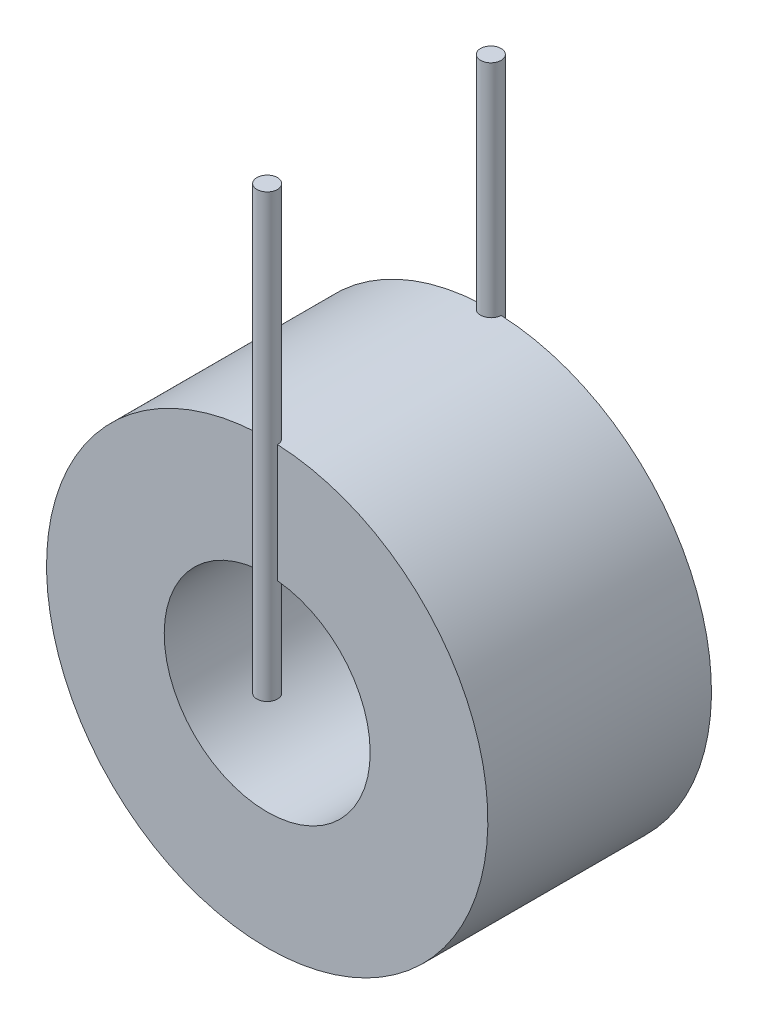
from build123d import *

# Parameters (mm, degrees)
EXTRUDE_1_DEPTH      = 3.8
EXTRUDE_1_DEPTH_BACK = 3.8
SKETCH_1_R           = 7.5
SKETCH_1_R_2         = 3.5
SKETCH_3_R           = 0.35
EXTRUDE_2_DEPTH      = 15


with BuildPart() as part:
    # 草图1 → 凸台-拉伸1 (new, two sides: drawn at the far end of the back side and taken through both)
    with BuildSketch(Plane.XY.offset(-EXTRUDE_1_DEPTH_BACK)):
        Circle(SKETCH_1_R)
        Circle(SKETCH_1_R_2, mode=Mode.SUBTRACT)
    extrude(amount=EXTRUDE_1_DEPTH + EXTRUDE_1_DEPTH_BACK)

    # 草图3 → 凸台-拉伸2 (add)
    with BuildSketch(Plane(origin=(0, 0, 0), x_dir=(1, 0, 0), z_dir=(0, 1, 0))):
        with Locations((0, 3.8)):
            Circle(SKETCH_3_R)
        with Locations((0, -3.8)):
            Circle(SKETCH_3_R)
    extrude(amount=EXTRUDE_2_DEPTH)


solid = part.part
